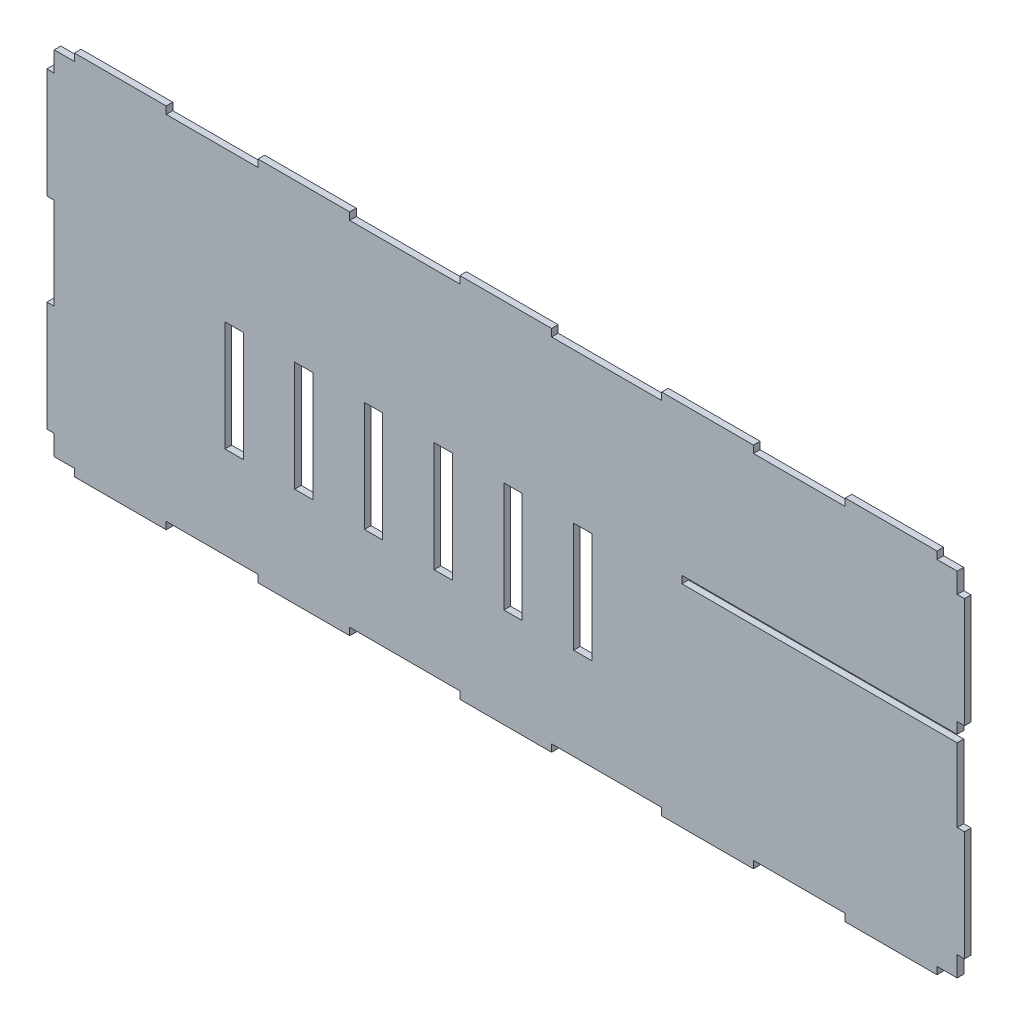
from build123d import *

# Parameters (mm, degrees)
SKETCH_1_W          = 500
SKETCH_1_H          = 200
EXTRUDE_1_DEPTH     = 3.6
SKETCH_3_W          = 4
SKETCH_3_H          = 50
CUT_EXTRUDE_2_DEPTH = 3.6
SKETCH_4_W          = 56.911563003
SKETCH_4_H          = 4
SKETCH_4_W_2        = 50
SKETCH_4_W_3        = 60
SKETCH_4_W_4        = 57.96169575
CUT_EXTRUDE_3_DEPTH = 10
SKETCH_5_W          = 10
SKETCH_5_H          = 60
CUT_EXTRUDE_4_DEPTH = 270.282305397
SKETCH_6_W          = 194.899640321
SKETCH_6_H          = 4
CUT_EXTRUDE_5_DEPTH = 270.282305397


with BuildPart() as part:
    # 草图1 → 凸台-拉伸1 (new body)
    with BuildSketch(Plane.XY):
        Rectangle(SKETCH_1_W, SKETCH_1_H)
    extrude(amount=EXTRUDE_1_DEPTH)

    # 草图3 → 切除-拉伸2 (cut)
    with BuildSketch(Plane.XY.offset(3.6)):
        with Locations((-248, 0)):
            Rectangle(SKETCH_3_W, SKETCH_3_H)
        with Locations((-248, 110)):
            Rectangle(SKETCH_3_W, SKETCH_3_H)
        with Locations((-248, -110)):
            Rectangle(SKETCH_3_W, SKETCH_3_H)
        with Locations((248, 110)):
            Rectangle(SKETCH_3_W, SKETCH_3_H)
        with Locations((248, 0)):
            Rectangle(SKETCH_3_W, SKETCH_3_H)
        with Locations((248, -110)):
            Rectangle(SKETCH_3_W, SKETCH_3_H)
    extrude(amount=-CUT_EXTRUDE_2_DEPTH, mode=Mode.SUBTRACT)

    # 草图4 → 切除-拉伸3 (cut)
    with BuildSketch(Plane.XY.offset(3.6)):
        with Locations((-263.455781502, -98)):
            Rectangle(SKETCH_4_W, SKETCH_4_H)
        with Locations((-160, -98)):
            Rectangle(SKETCH_4_W_2, SKETCH_4_H)
        with Locations((-55, -98)):
            Rectangle(SKETCH_4_W_3, SKETCH_4_H)
        with Locations((55, -98)):
            Rectangle(SKETCH_4_W_3, SKETCH_4_H)
        with Locations((160, -98)):
            Rectangle(SKETCH_4_W_2, SKETCH_4_H)
        with Locations((263.980847875, -98)):
            Rectangle(SKETCH_4_W_4, SKETCH_4_H)
        with Locations((263.980847875, 98)):
            Rectangle(SKETCH_4_W_4, SKETCH_4_H)
        with Locations((160, 98)):
            Rectangle(SKETCH_4_W_2, SKETCH_4_H)
        with Locations((55, 98)):
            Rectangle(SKETCH_4_W_3, SKETCH_4_H)
        with Locations((-55, 98)):
            Rectangle(SKETCH_4_W_3, SKETCH_4_H)
        with Locations((-160, 98)):
            Rectangle(SKETCH_4_W_2, SKETCH_4_H)
        with Locations((-263.455781502, 98)):
            Rectangle(SKETCH_4_W, SKETCH_4_H)
    extrude(amount=-CUT_EXTRUDE_3_DEPTH, mode=Mode.SUBTRACT)

    # 草图5 → 切除-拉伸4 (cut, through all)
    with BuildSketch(Plane.XY.offset(3.6)):
        with Locations((-148, -15.837417242)):
            Rectangle(SKETCH_5_W, SKETCH_5_H)
        with Locations((-110, -15.837417242)):
            Rectangle(SKETCH_5_W, SKETCH_5_H)
        with Locations((-72, -15.837417242)):
            Rectangle(SKETCH_5_W, SKETCH_5_H)
        with Locations((-34, -15.837417242)):
            Rectangle(SKETCH_5_W, SKETCH_5_H)
        with Locations((4, -15.837417242)):
            Rectangle(SKETCH_5_W, SKETCH_5_H)
        with Locations((42, -15.837417242)):
            Rectangle(SKETCH_5_W, SKETCH_5_H)
    extrude(amount=-CUT_EXTRUDE_4_DEPTH, mode=Mode.SUBTRACT)

    # 草图6 → 切除-拉伸5 (cut, through all)
    with BuildSketch(Plane.XY.offset(3.6)):
        with Locations((193.44982016, 17)):
            Rectangle(SKETCH_6_W, SKETCH_6_H)
    extrude(amount=-CUT_EXTRUDE_5_DEPTH, mode=Mode.SUBTRACT)


solid = part.part
